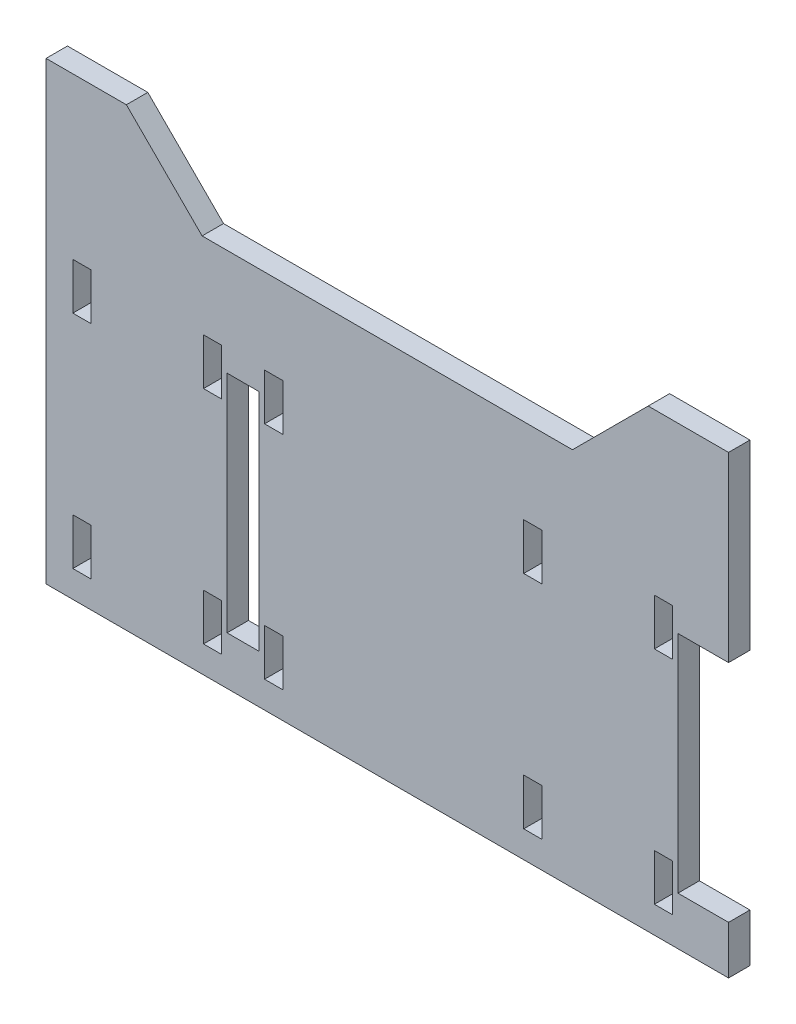
from build123d import *

# Parameters (mm, degrees)
SKETCH1_W           = 3.4
SKETCH1_H           = 8.7
SKETCH1_W_2         = 6
SKETCH1_H_2         = 42
BOSS_EXTRUDE1_DEPTH = 4
BOSS_EXTRUDE2_DEPTH = 4


with BuildPart() as part:
    # Sketch1 → Boss-Extrude1 (new body)
    with BuildSketch(Plane.XY):
        Polygon((-66.7, 30), (-66.7, -30), (55.3, -30), (60.740194605, -30), (60.740194605, -21), (58.8, -21), (51.3, -21), (51.3, 21), (58.8, 21), (60.740194605, 21), (60.740194605, 30), (55.3, 30), align=None)
        with Locations((-35.6, 20.65)):
            Rectangle(SKETCH1_W, SKETCH1_H, mode=Mode.SUBTRACT)
        with Locations((24.2, 20.65)):
            Rectangle(SKETCH1_W, SKETCH1_H, mode=Mode.SUBTRACT)
        with Locations((24.2, -20.65)):
            Rectangle(SKETCH1_W, SKETCH1_H, mode=Mode.SUBTRACT)
        with Locations((-24.2, 20.65)):
            Rectangle(SKETCH1_W, SKETCH1_H, mode=Mode.SUBTRACT)
        with Locations((-24.2, -20.65)):
            Rectangle(SKETCH1_W, SKETCH1_H, mode=Mode.SUBTRACT)
        with Locations((48.6, 20.65)):
            Rectangle(SKETCH1_W, SKETCH1_H, mode=Mode.SUBTRACT)
        with Locations((48.6, -20.65)):
            Rectangle(SKETCH1_W, SKETCH1_H, mode=Mode.SUBTRACT)
        with Locations((-35.6, -20.65)):
            Rectangle(SKETCH1_W, SKETCH1_H, mode=Mode.SUBTRACT)
        with Locations((-60, 20.65)):
            Rectangle(SKETCH1_W, SKETCH1_H, mode=Mode.SUBTRACT)
        with Locations((-60, -20.65)):
            Rectangle(SKETCH1_W, SKETCH1_H, mode=Mode.SUBTRACT)
        with Locations((-29.9, 0)):
            Rectangle(SKETCH1_W_2, SKETCH1_H_2, mode=Mode.SUBTRACT)
    extrude(amount=BOSS_EXTRUDE1_DEPTH)

    # Sketch2 → Boss-Extrude2 (add)
    with BuildSketch(Plane.XY):
        Polygon((-66.7, 30), (-66.7, 55), (-51.7, 55), (-37.557864376, 40.857864376), (31.598058981, 40.857864376), (45.740194605, 55), (60.740194605, 55), (60.740194605, 30), align=None)
    extrude(amount=BOSS_EXTRUDE2_DEPTH)


solid = part.part
